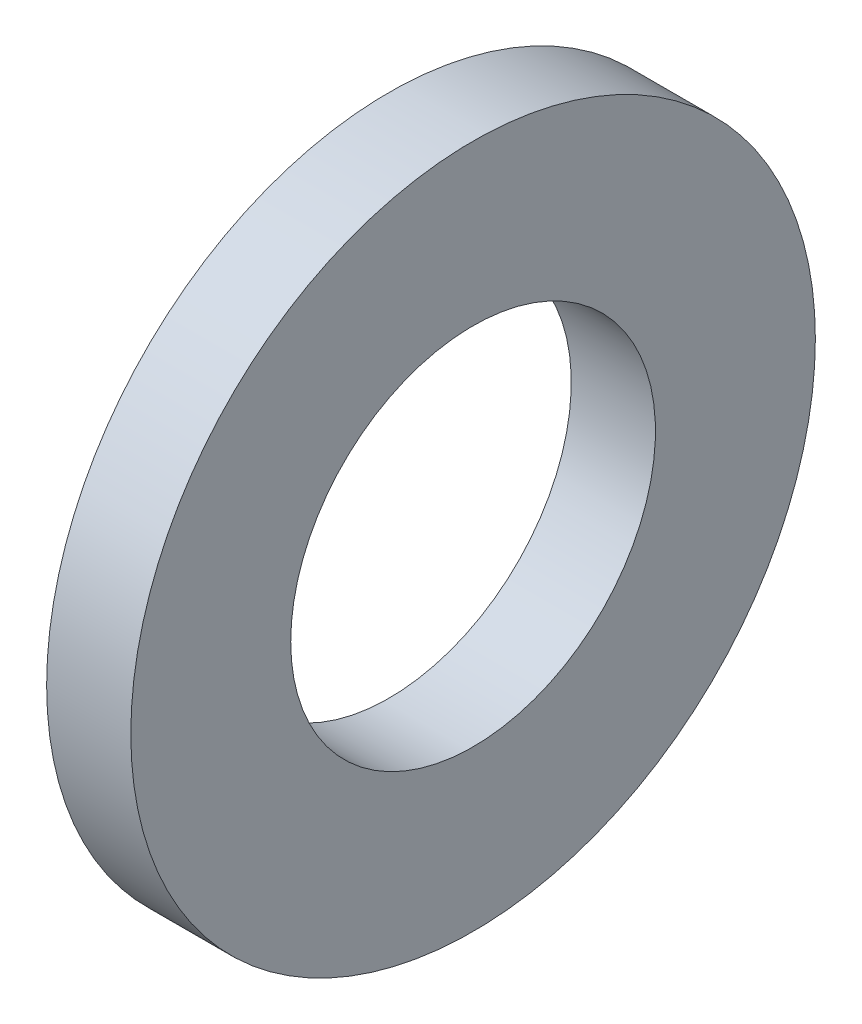
from build123d import *

# Parameters (mm, degrees)
SKETCH1_W = 1.5
SKETCH1_H = 2.85


with BuildPart() as part:
    # Sketch1 → Revolve1 (revolve)
    with BuildSketch(Plane.XY, mode=Mode.PRIVATE) as revolve1_sk:
        with Locations((0.75, 4.675)):
            Rectangle(SKETCH1_W, SKETCH1_H)
    revolve(revolve1_sk.sketch.rotate(Axis((0, 0, 0), (1, 0, 0)), 90), axis=Axis((0, 0, 0), (1, 0, 0)))


solid = part.part
